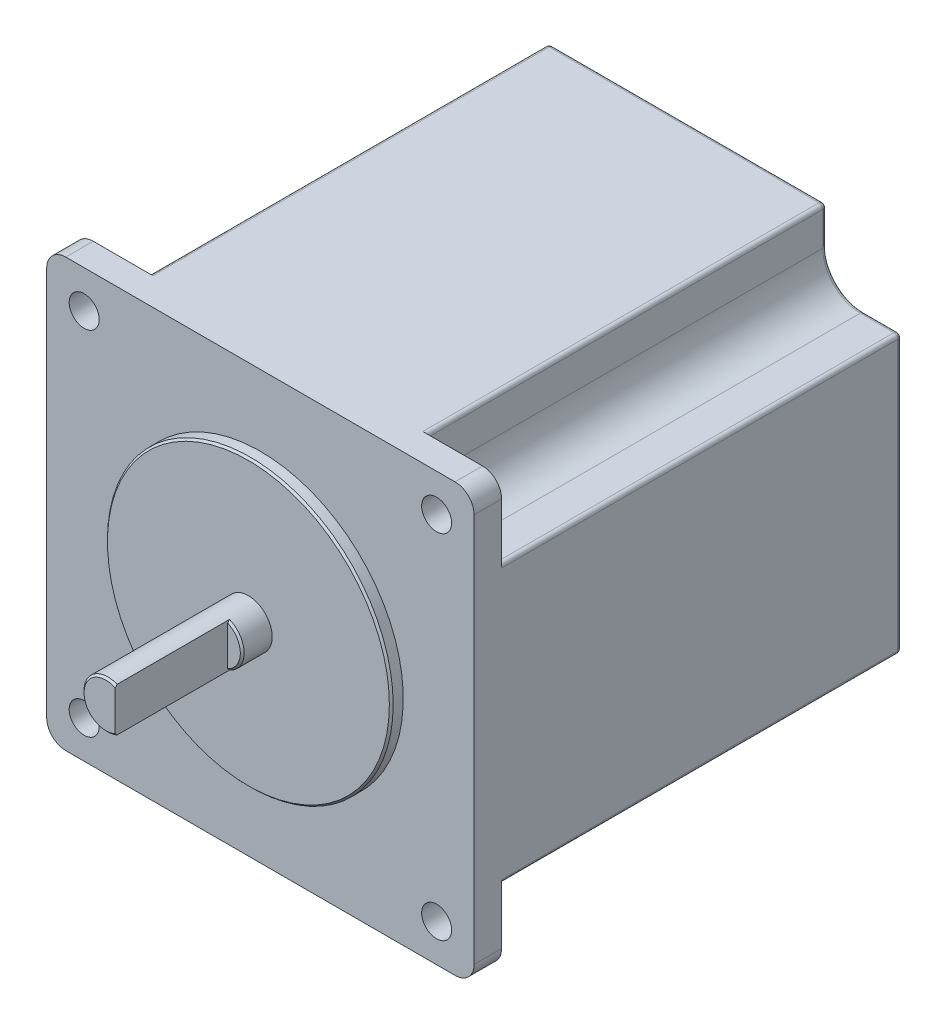
from build123d import *

# Parameters (mm, degrees)
SKETCH1_W           = 57
SKETCH1_H           = 57
BOSS_EXTRUDE1_DEPTH = 57
SKETCH2_R           = 2
CUT_EXTRUDE1_DEPTH  = 70.810457669
CUT_EXTRUDE4_DEPTH  = 53.34
FILLET1_R           = 2.54
SKETCH9_R           = 19.05
BOSS_EXTRUDE2_DEPTH = 1.6
SKETCH10_R          = 3.175
BOSS_EXTRUDE3_DEPTH = 19
CUT_EXTRUDE5_START  = -15
CUT_EXTRUDE5_DEPTH  = 15
CHAMFER1_SIZE       = 0.254
FILLET2_R           = 0.508


with BuildPart() as part:
    # Sketch1 → Boss-Extrude1 (new body)
    with BuildSketch(Plane.XY):
        Rectangle(SKETCH1_W, SKETCH1_H)
    extrude(amount=BOSS_EXTRUDE1_DEPTH)

    # Sketch2 → Cut-Extrude1 (cut, through all)
    with BuildSketch(Plane.XY.offset(57)):
        with Locations((-23.5, 23.5)):
            Circle(SKETCH2_R)
        with Locations((23.5, 23.5)):
            Circle(SKETCH2_R)
        with Locations((23.5, -23.5)):
            Circle(SKETCH2_R)
        with Locations((-23.5, -23.5)):
            Circle(SKETCH2_R)
    extrude(amount=-CUT_EXTRUDE1_DEPTH, mode=Mode.SUBTRACT)

    # Sketch8 → Cut-Extrude4 (cut)
    with BuildSketch(Plane(origin=(0, 0, 0), x_dir=(-1, 0, 0), z_dir=(0, 0, -1))):
        with BuildLine():
            Line((18.5, -28.5), (18.5, -23.5))
            ThreePointArc((18.5, -23.5), (19.964466094, -19.964466094), (23.5, -18.5))
            Line((23.5, -18.5), (28.5, -18.5))
            Line((28.5, -18.5), (28.5, -28.5))
            Line((28.5, -28.5), (18.5, -28.5))
        make_face()
        with BuildLine():
            Line((23.5, 18.5), (28.5, 18.5))
            Line((28.5, 18.5), (28.5, 28.5))
            Line((28.5, 28.5), (18.5, 28.5))
            Line((18.5, 28.5), (18.5, 23.5))
            ThreePointArc((18.5, 23.5), (19.964466094, 19.964466094), (23.5, 18.5))
        make_face()
        with BuildLine():
            Line((-18.5, 23.5), (-18.5, 28.5))
            Line((-18.5, 28.5), (-28.5, 28.5))
            Line((-28.5, 28.5), (-28.5, 18.5))
            Line((-28.5, 18.5), (-23.5, 18.5))
            ThreePointArc((-23.5, 18.5), (-19.964466094, 19.964466094), (-18.5, 23.5))
        make_face()
        with BuildLine():
            Line((-23.5, -18.5), (-28.5, -18.5))
            Line((-28.5, -18.5), (-28.5, -28.5))
            Line((-28.5, -28.5), (-18.5, -28.5))
            Line((-18.5, -28.5), (-18.5, -23.5))
            ThreePointArc((-18.5, -23.5), (-19.964466094, -19.964466094), (-23.5, -18.5))
        make_face()
    extrude(amount=-CUT_EXTRUDE4_DEPTH, mode=Mode.SUBTRACT)

    # Fillet1
    fillet1_edges = [part.edges().sort_by_distance(p)[0] for p in [
        (28.5, -28.5, 55.17),
        (-28.5, -28.5, 55.17),
        (-28.5, 28.5, 55.17),
        (28.5, 28.5, 55.17),
    ]]
    fillet(fillet1_edges, radius=FILLET1_R)

    # Sketch9 → Boss-Extrude2 (add)
    with BuildSketch(Plane.XY.offset(57)):
        with Locations(Location((0, 0, 0), (0, 0, 180))):
            Circle(SKETCH9_R)
    extrude(amount=BOSS_EXTRUDE2_DEPTH)

    # Sketch10 → Boss-Extrude3 (add)
    with BuildSketch(Plane.XY.offset(58.6)):
        Circle(SKETCH10_R)
    extrude(amount=BOSS_EXTRUDE3_DEPTH)

    # Sketch11 → Cut-Extrude5 (cut)
    with BuildSketch(Plane.XY.offset(77.6).offset(CUT_EXTRUDE5_START)):
        with BuildLine():
            Line((1.234908904, -2.925), (1.234908904, 2.925))
            ThreePointArc((1.234908904, 2.925), (3.175, 0), (1.234908904, -2.925))
        make_face()
    extrude(amount=CUT_EXTRUDE5_DEPTH, mode=Mode.SUBTRACT)

    # Chamfer1
    chamfer1_edges = [part.edges().sort_by_distance(p)[0] for p in [
        (19.05, 0, 58.6),
        (-3.175, 0, 77.6),
        (2.645889337, -1.754962853, 62.6),
    ]]
    chamfer(chamfer1_edges, length=CHAMFER1_SIZE)

    # Fillet2
    fillet2_edges = [part.edges().sort_by_distance(p)[0] for p in [
        (0, -28.5, 0),
        (-26, -18.5, 0),
        (-19.964466094, -19.964466094, 0),
        (-18.5, -26, 0),
        (-18.5, -28.5, 26.67),
        (-28.5, -18.5, 26.67),
        (-28.5, 0, 0),
        (0, 28.5, 0),
        (28.5, 0, 0),
        (18.5, -26, 0),
        (19.964466094, -19.964466094, 0),
        (26, -18.5, 0),
        (28.5, -18.5, 26.67),
        (18.5, -28.5, 26.67),
        (26, 18.5, 0),
        (19.964466094, 19.964466094, 0),
        (18.5, 26, 0),
        (18.5, 28.5, 26.67),
        (28.5, 18.5, 26.67),
        (-19.964466094, 19.964466094, 0),
        (-26, 18.5, 0),
        (-18.5, 26, 0),
        (-18.5, 28.5, 26.67),
        (-28.5, 18.5, 26.67),
    ]]
    fillet(fillet2_edges, radius=FILLET2_R)


solid = part.part
